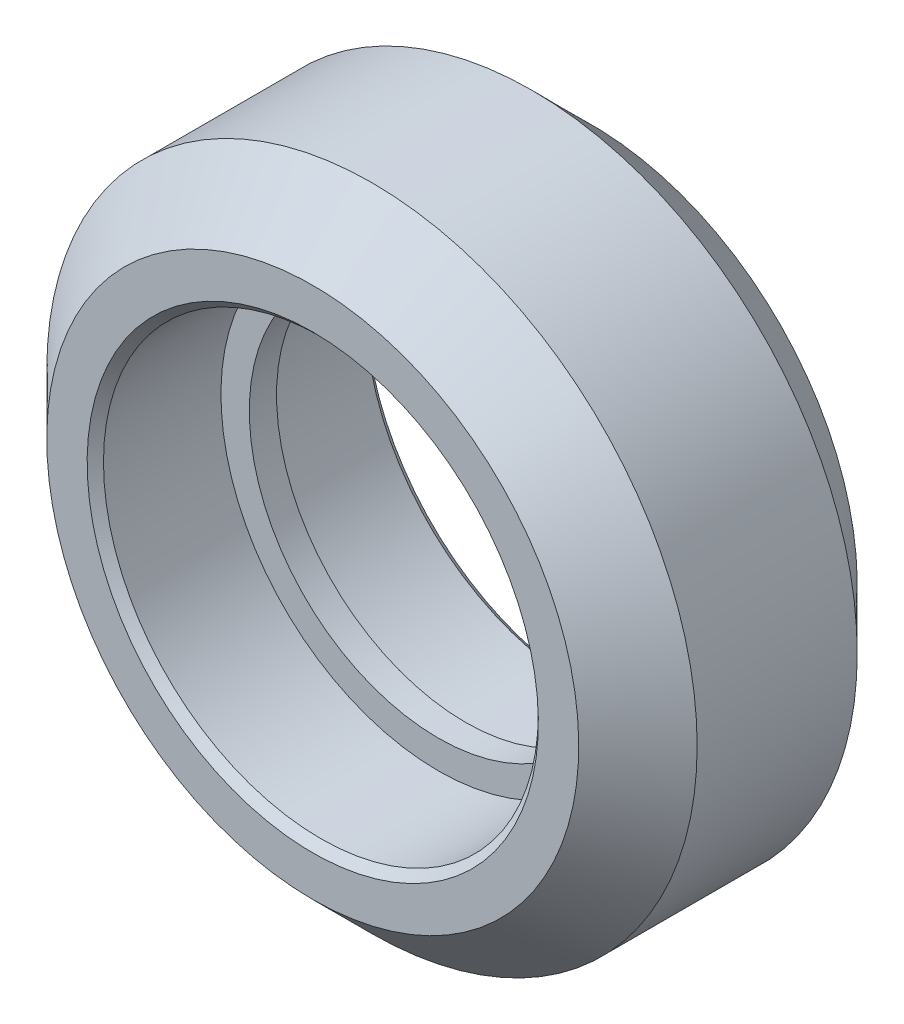
from build123d import *

# Parameters (mm, degrees)
CHAMFER1_SIZE = 0.3


with BuildPart() as part:
    # Sketch1 → Revolve1 (revolve)
    with BuildSketch(Plane(origin=(0, 0, 0), x_dir=(0, 0, -1), z_dir=(1, 0, 0)), mode=Mode.PRIVATE) as revolve1_sk:
        Polygon((-2.94, 11.945), (2.94, 11.945), (5.115, 9.77), (5.115, 7.987), (0.5, 7.987), (0.5, 6.945), (-0.5, 6.945), (-0.5, 7.987), (-5.115, 7.987), (-5.115, 9.77), align=None)
    revolve(revolve1_sk.sketch.rotate(Axis((0, 0, 5.115), (0, 0, -1)), 180), axis=Axis((0, 0, 5.115), (0, 0, -1)))

    # Chamfer1
    chamfer1_edges = [part.edges().sort_by_distance(p)[0] for p in [
        (0, 7.987, 5.115),
        (0, 7.987, -5.115),
    ]]
    chamfer(chamfer1_edges, length=CHAMFER1_SIZE)


solid = part.part
